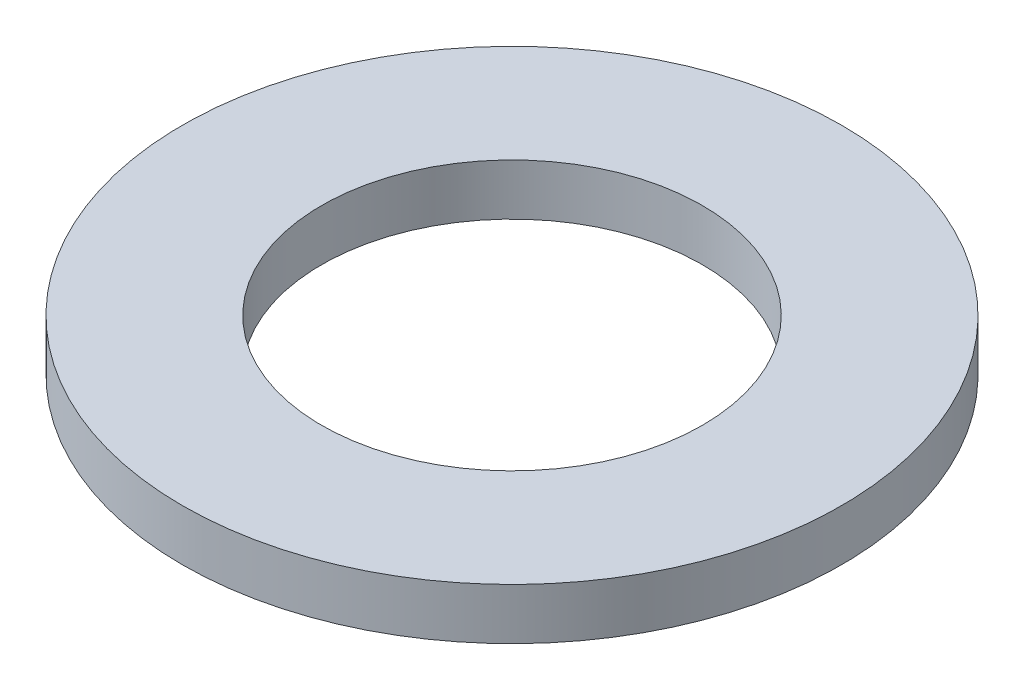
from build123d import *

# Parameters (mm, degrees)
SKETCH1_R           = 4.5
SKETCH1_R_2         = 2.6
EXTRUDE_THIN1_DEPTH = 0.7


with BuildPart() as part:
    # Sketch1 → Extrude-Thin1 (new body)
    with BuildSketch(Plane(origin=(0, 0, 0), x_dir=(1, 0, 0), z_dir=(0, 1, 0))):
        Circle(SKETCH1_R)
        Circle(SKETCH1_R_2, mode=Mode.SUBTRACT)
    extrude(amount=EXTRUDE_THIN1_DEPTH)


solid = part.part
